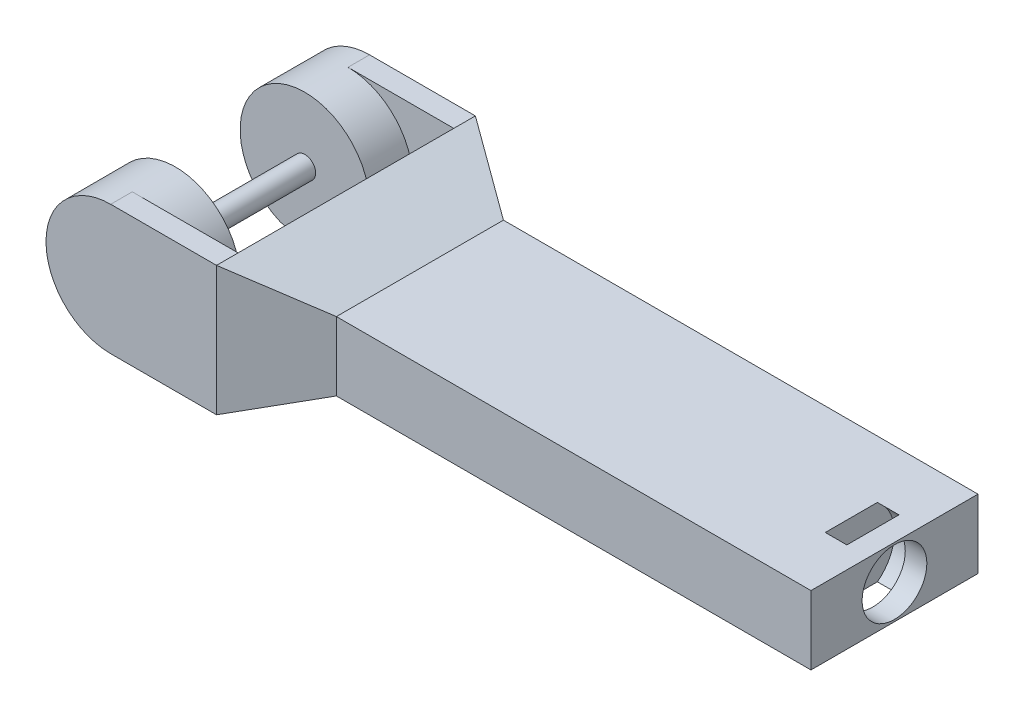
from build123d import *

# Parameters (mm, degrees)
SKETCH1_R                    = 5
BOSS_EXTRUDE1_DEPTH          = 30
SKETCH2_R                    = 30
BOSS_EXTRUDE2_DEPTH          = 20
BOSS_EXTRUDE3_DEPTH          = 10
BOSS_EXTRUDE4_DEPTH          = 60
CUT_EXTRUDE2_DEPTH           = 107.979678493
SCHIZZO1_W                   = 77.430619172
SCHIZZO1_H                   = 31.885326398
ESTRUSIONE_ESTRUSIONE1_DEPTH = 220
SKETCH8_R                    = 15
CUT_EXTRUDE3_DEPTH           = 10
SKETCH9_R                    = 20
CUT_EXTRUDE4_DEPTH           = 10


with BuildPart() as part:
    # Sketch1 → Boss-Extrude1 (new, symmetric)
    with BuildSketch(Plane.XY):
        Circle(SKETCH1_R)
    extrude(amount=BOSS_EXTRUDE1_DEPTH, both=True)

    # Sketch2 → Boss-Extrude2 (add)
    with BuildSketch(Plane.XY.offset(30)):
        Circle(SKETCH2_R)
    boss_extrude2 = extrude(amount=BOSS_EXTRUDE2_DEPTH)

    # Mirror1: Boss-Extrude2 across plane
    add(boss_extrude2.mirror(Plane.XY))

    # Sketch5 → Boss-Extrude3 (add)
    with BuildSketch(Plane.XY.offset(50)):
        with BuildLine():
            Line((49.046850524, 30), (49.046850524, -30))
            Line((49.046850524, -30), (0, -30))
            ThreePointArc((0, -30), (-30, 0), (0, 30))
            Line((0, 30), (49.046850524, 30))
        make_face()
    boss_extrude3 = extrude(amount=BOSS_EXTRUDE3_DEPTH)

    # Mirror3: Boss-Extrude3 across plane
    add(boss_extrude3.mirror(Plane.XY))

    # Sketch6 → Boss-Extrude4 (add, symmetric)
    with BuildSketch(Plane.XY):
        Polygon((49.046850524, -30), (49.046850524, 30), (83.33457632, 15.942663199), (83.33457632, -15.942663199), align=None)
    extrude(amount=BOSS_EXTRUDE4_DEPTH, both=True)

    # Sketch7 → Cut-Extrude2 (cut, symmetric)
    with BuildSketch(Plane(origin=(0, 0, 0), x_dir=(1, 0, 0), z_dir=(0, 1, 0))):
        Polygon((-220.635461706, 227.409893565), (49.046850524, 60), (92.240822161, 33.186605623), (361.923134392, -134.223287942), (696.742921522, 405.141336519), (114.184325424, 766.774518026), align=None)
    cut_extrude2 = extrude(amount=CUT_EXTRUDE2_DEPTH, both=True, mode=Mode.SUBTRACT)

    # Mirror4: Cut-Extrude2 across plane
    add(cut_extrude2.mirror(Plane.XY), mode=Mode.SUBTRACT)

    # Schizzo1 → Estrusione-Estrusione1 (add)
    with BuildSketch(Plane(origin=(83.33457632, 0, 0), x_dir=(0, 0, -1), z_dir=(1, 0, 0))):
        Rectangle(SCHIZZO1_W, SCHIZZO1_H)
    extrude(amount=ESTRUSIONE_ESTRUSIONE1_DEPTH)

    # Sketch8 → Cut-Extrude3 (cut)
    with BuildSketch(Plane(origin=(303.33457632, 0, 0), x_dir=(0, 0, -1), z_dir=(1, 0, 0))):
        Circle(SKETCH8_R)
    extrude(amount=-CUT_EXTRUDE3_DEPTH, mode=Mode.SUBTRACT)

    # Sketch9 → Cut-Extrude4 (cut)
    with BuildSketch(Plane(origin=(293.33457632, 0, 0), x_dir=(0, 0, -1), z_dir=(1, 0, 0))):
        Circle(SKETCH9_R)
    extrude(amount=-CUT_EXTRUDE4_DEPTH, mode=Mode.SUBTRACT)


solid = part.part
